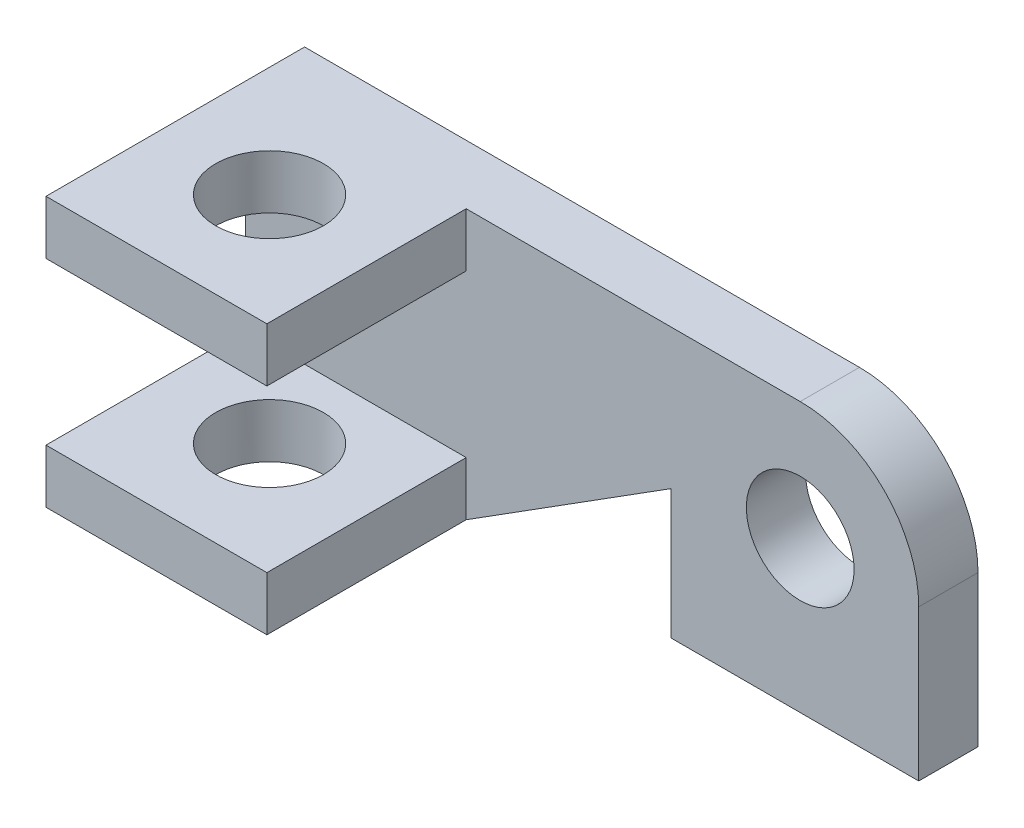
from build123d import *

# Parameters (mm, degrees)
SKETCH1_R           = 10
BOSS_EXTRUDE1_DEPTH = 11
SKETCH2_W           = 41
SKETCH2_H           = 10
BOSS_EXTRUDE2_DEPTH = 37
SKETCH3_R           = 10
CUT_EXTRUDE1_DEPTH  = 125.149103903


with BuildPart() as part:
    # Sketch1 → Boss-Extrude1 (new body)
    with BuildSketch(Plane.XY):
        with BuildLine():
            Line((-24, -28), (22, -28))
            Line((22, -28), (22, 0))
            ThreePointArc((22, 0), (15.556349186, 15.556349186), (0, 22))
            Line((0, 22), (-103, 22))
            Line((-103, 22), (-103, -28))
            Line((-103, -28), (-62, -28))
            Line((-62, -28), (-24, -4))
            Line((-24, -4), (-24, -28))
        make_face()
        Circle(SKETCH1_R, mode=Mode.SUBTRACT)
    extrude(amount=BOSS_EXTRUDE1_DEPTH)

    # Sketch2 → Boss-Extrude2 (add)
    with BuildSketch(Plane.XY.offset(11)):
        with Locations((-82.5, 17)):
            Rectangle(SKETCH2_W, SKETCH2_H)
        with Locations((-82.5, -23)):
            Rectangle(SKETCH2_W, SKETCH2_H)
    extrude(amount=BOSS_EXTRUDE2_DEPTH)

    # Sketch3 → Cut-Extrude1 (cut, through all)
    with BuildSketch(Plane.XZ.offset(28)):
        with Locations((-82.5, 27)):
            Circle(SKETCH3_R)
    extrude(amount=-CUT_EXTRUDE1_DEPTH, mode=Mode.SUBTRACT)


solid = part.part
